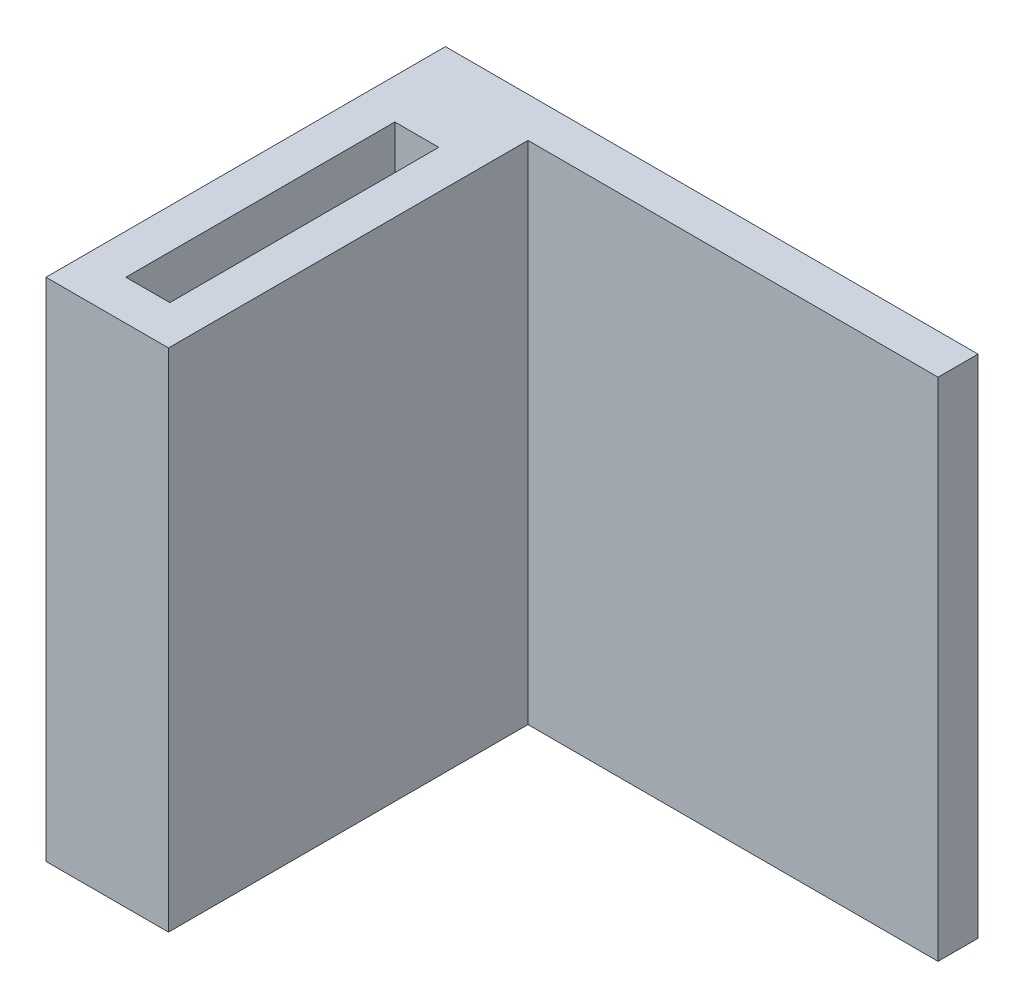
from build123d import *

# Parameters (mm, degrees)
BOSS_EXTRUDE1_DEPTH = 4.5
SKETCH1_3_W         = 1.65
SKETCH1_3_H         = 10.1
BOSS_EXTRUDE2_DEPTH = 19


with BuildPart() as part:
    # Sketch1 → Boss-Extrude1 (new body)
    with BuildSketch(Plane(origin=(0, 0, 0), x_dir=(1, 0, 0), z_dir=(0, 1, 0))):
        Polygon((0, 0), (0, 15), (20, 15), (20, 13.5), (4.6, 13.5), (4.6, 0), align=None)
    extrude(amount=BOSS_EXTRUDE1_DEPTH)

    # Sketch1<3> → Boss-Extrude2 (add)
    with BuildSketch(Plane(origin=(0, 0, 0), x_dir=(1, 0, 0), z_dir=(0, 1, 0))):
        Polygon((0, 0), (0, 15), (20, 15), (20, 13.5), (4.6, 13.5), (4.6, 0), align=None)
        with Locations((2.325, 6.55)):
            Rectangle(SKETCH1_3_W, SKETCH1_3_H, mode=Mode.SUBTRACT)
    extrude(amount=BOSS_EXTRUDE2_DEPTH)


solid = part.part
